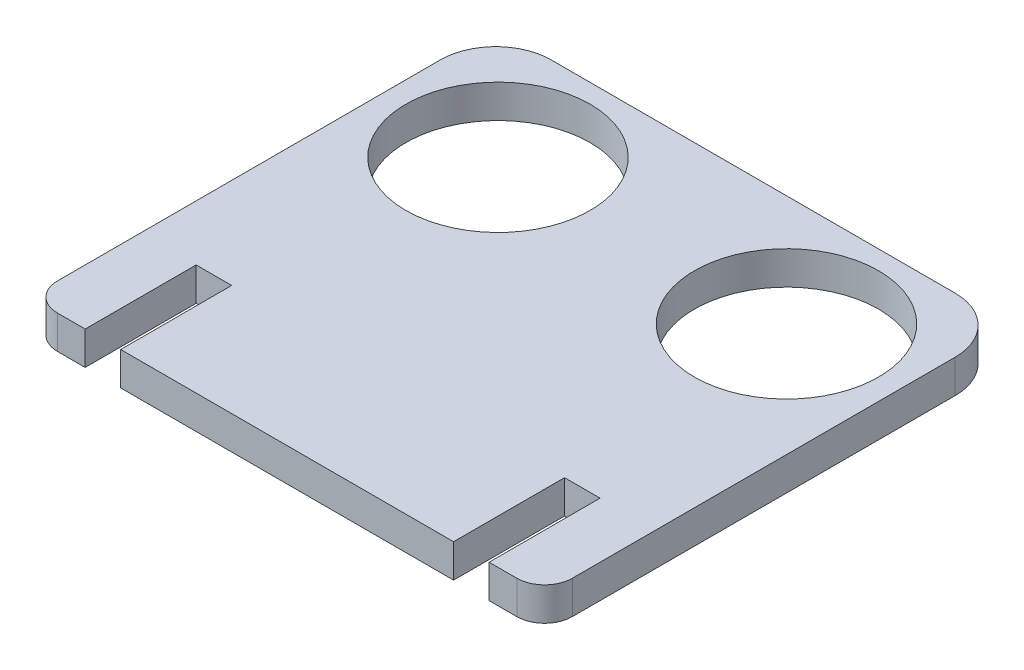
from build123d import *

# Parameters (mm, degrees)
SKETCH_1_R      = 8.3
EXTRUDE_1_DEPTH = 3


with BuildPart() as part:
    # 草图1 → 凸台-拉伸1 (new body)
    with BuildSketch(Plane(origin=(0, 0, 0), x_dir=(1, 0, 0), z_dir=(0, 1, 0))):
        with BuildLine():
            Line((-15, 0), (-15, -10))
            Line((-15, -10), (15, -10))
            Line((15, -10), (15, 0))
            Line((15, 0), (18.2, 0))
            Line((18.2, 0), (18.2, -10))
            Line((18.2, -10), (20.7, -10))
            ThreePointArc((20.7, -10), (22.467766953, -9.267766953), (23.2, -7.5))
            Line((23.2, -7.5), (23.2, 12))
            Line((23.2, 12), (23.2, 27))
            ThreePointArc((23.2, 27), (21.735533906, 30.535533906), (18.2, 32))
            Line((18.2, 32), (-18.2, 32))
            ThreePointArc((-18.2, 32), (-21.735533906, 30.535533906), (-23.2, 27))
            Line((-23.2, 27), (-23.2, 12))
            Line((-23.2, 12), (-23.2, -7.5))
            ThreePointArc((-23.2, -7.5), (-22.467766953, -9.267766953), (-20.7, -10))
            Line((-20.7, -10), (-18.2, -10))
            Line((-18.2, -10), (-18.2, 0))
            Line((-18.2, 0), (-15, 0))
        make_face()
        with Locations(Location((13, 22, 0), (0, 0, 270))):
            Circle(SKETCH_1_R, mode=Mode.SUBTRACT)
        with Locations(Location((-13, 22, 0), (0, 0, 90))):
            Circle(SKETCH_1_R, mode=Mode.SUBTRACT)
    extrude(amount=EXTRUDE_1_DEPTH)


solid = part.part
